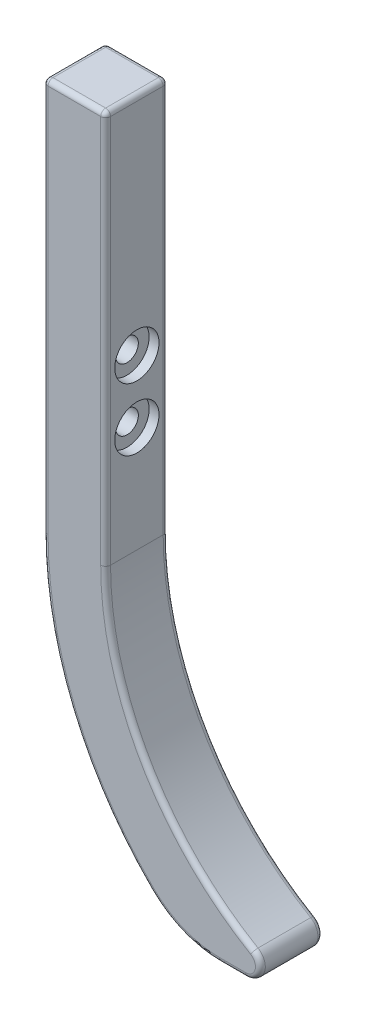
from build123d import *

# Parameters (mm, degrees)
BOSS_EXTRUDE1_DEPTH = 12.7
FILLET1_R           = 3
FILLET2_R           = 20
CUT_EXTRUDE1_REACH  = 88.899
SKETCH2_R           = 2.3
SKETCH2_3_R         = 4.5
SKETCH2_3_R_2       = 2.3
CUT_EXTRUDE2_DEPTH  = 2
FILLET3_R           = 1
FILLET4_R           = 1


with BuildPart() as part:
    # Sketch1 → Boss-Extrude1 (new body)
    with BuildSketch(Plane.XY):
        with BuildLine():
            Line((-60.8, 0), (-60.8, 80))
            Line((-60.8, 80), (-73.5, 80))
            Line((-73.5, 80), (-73.5, 0))
            ThreePointArc((-73.5, 0), (-66.0323905, -32.279612836), (-45.14698218, -58))
            Line((-45.14698218, -58), (-18.238420984, -58))
            ThreePointArc((-18.238420984, -58), (-49.018037475, -35.970432331), (-60.8, 0))
        make_face()
    extrude(amount=BOSS_EXTRUDE1_DEPTH)

    # Fillet1
    fillet1_edges = [part.edges().sort_by_distance(p)[0] for p in [
        (-18.238420984, -58, 6.35),
    ]]
    fillet(fillet1_edges, radius=FILLET1_R)

    # Fillet2
    fillet2_edges = [part.edges().sort_by_distance(p)[0] for p in [
        (-45.14698218, -58, 6.35),
    ]]
    fillet(fillet2_edges, radius=FILLET2_R)

    # Sketch2 → Cut-Extrude1 (cut, up to next)
    with BuildSketch(Plane(origin=(-60.8, 0, 0), x_dir=(0, 0, -1), z_dir=(1, 0, 0)), mode=Mode.PRIVATE) as cut_extrude1_sk1:
        with Locations((-6.35, 21.58)):
            Circle(SKETCH2_R)
    cut_extrude1_tool1 = extrude(cut_extrude1_sk1.sketch, amount=-CUT_EXTRUDE1_REACH, mode=Mode.PRIVATE) & part.part
    # Sketch2 → Cut-Extrude1 (cut, up to next)
    with BuildSketch(Plane(origin=(-60.8, 0, 0), x_dir=(0, 0, -1), z_dir=(1, 0, 0)), mode=Mode.PRIVATE) as cut_extrude1_sk2:
        with Locations((-6.35, 34.28)):
            Circle(SKETCH2_R)
    cut_extrude1_tool2 = extrude(cut_extrude1_sk2.sketch, amount=-CUT_EXTRUDE1_REACH, mode=Mode.PRIVATE) & part.part
    add(cut_extrude1_tool1.solids().sort_by_distance((-60.8, 21.58, 6.35))[0], mode=Mode.SUBTRACT)
    add(cut_extrude1_tool2.solids().sort_by_distance((-60.8, 34.28, 6.35))[0], mode=Mode.SUBTRACT)

    # Sketch2<3> → Cut-Extrude2 (cut)
    # profile 1 of 2: a face of its own
    with BuildSketch(Plane(origin=(-60.8, 0, 0), x_dir=(0, 0, -1), z_dir=(1, 0, 0))):
        with Locations((-6.35, 34.28)):
            Circle(SKETCH2_3_R)
        with Locations((-6.35, 34.28)):
            Circle(SKETCH2_3_R_2, mode=Mode.SUBTRACT)
    # profile 2 of 2: a face of its own
    with BuildSketch(Plane(origin=(-60.8, 0, 0), x_dir=(0, 0, -1), z_dir=(1, 0, 0))):
        with Locations((-6.35, 21.58)):
            Circle(SKETCH2_3_R)
        with Locations((-6.35, 21.58)):
            Circle(SKETCH2_3_R_2, mode=Mode.SUBTRACT)
    extrude(amount=-CUT_EXTRUDE2_DEPTH, mode=Mode.SUBTRACT)

    # Fillet3
    fillet3_edges = [part.edges().sort_by_distance(p)[0] for p in [
        (-73.5, 40, 0),
        (-67.841711996, -28.279888852, 0),
        (-45.271750842, -56.494758035, 0),
        (-34.99646236, -58, 0),
        (-29.438560761, -55.787838597, 0),
        (-52.773401506, -30.192848383, 0),
        (-73.5, 40, 12.7),
        (-67.841711996, -28.279888852, 12.7),
        (-45.271750842, -56.494758035, 12.7),
        (-34.99646236, -58, 12.7),
        (-29.438560761, -55.787838597, 12.7),
        (-52.773401506, -30.192848383, 12.7),
        (-60.8, 40, 0),
        (-60.8, 40, 12.7),
    ]]
    fillet(fillet3_edges, radius=FILLET3_R)

    # Fillet4
    fillet4_edges = [part.edges().sort_by_distance(p)[0] for p in [
        (-61.092893219, 80, 12.407106781),
        (-60.8, 80, 6.35),
        (-61.092893219, 80, 0.292893219),
        (-67.15, 80, 0),
        (-73.207106781, 80, 0.292893219),
        (-73.5, 80, 6.35),
        (-73.207106781, 80, 12.407106781),
        (-67.15, 80, 12.7),
    ]]
    fillet(fillet4_edges, radius=FILLET4_R)


solid = part.part
